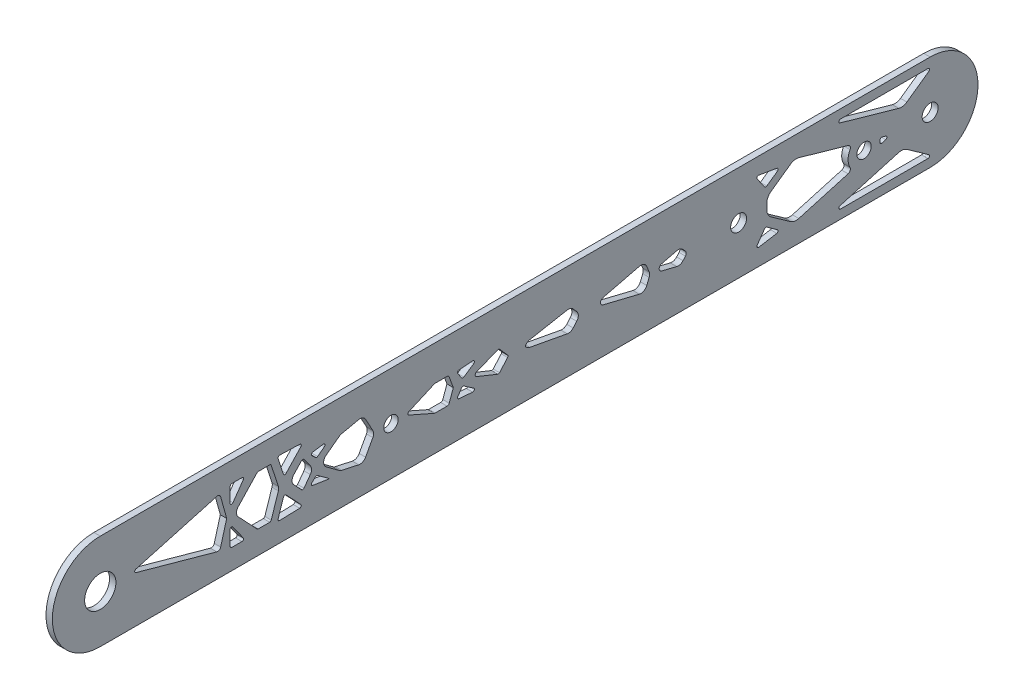
from build123d import *

# Parameters (mm, degrees)
SKETCH1_R           = 2.5
SKETCH1_R_2         = 4.9
BOSS_EXTRUDE1_DEPTH = 2
CUT_EXTRUDE1_DEPTH  = 216.531900191
SKETCH7_R           = 5
SKETCH7_R_2         = 2.25
BOSS_EXTRUDE2_DEPTH = 2
FILLET1_R           = 1
FILLET2_R           = 0.5
SKETCH8_R           = 2.25
CUT_EXTRUDE2_DEPTH  = 216.531900191


with BuildPart() as part:
    # Sketch1 → Boss-Extrude1 (new body)
    with BuildSketch(Plane(origin=(0, 0, 0), x_dir=(0, 0, -1), z_dir=(1, 0, 0))):
        with BuildLine():
            Line((-200, -15), (60, -15))
            ThreePointArc((60, -15), (75, 0), (60, 15))
            Line((60, 15), (-200, 15))
            ThreePointArc((-200, 15), (-215, 0), (-200, -15))
        make_face()
        Circle(SKETCH1_R, mode=Mode.SUBTRACT)
        with Locations((-200, 0)):
            Circle(SKETCH1_R_2, mode=Mode.SUBTRACT)
        with Locations((60, 0)):
            Circle(SKETCH1_R, mode=Mode.SUBTRACT)
    extrude(amount=BOSS_EXTRUDE1_DEPTH)

    # Sketch6 → Cut-Extrude1 (cut, through all)
    with BuildSketch(Plane(origin=(2, 0, 0), x_dir=(0, 0, -1), z_dir=(1, 0, 0))):
        with BuildLine():
            Line((-160.387518607, 0), (-189.218486106, 0))
            ThreePointArc((-189.218486106, 0), (-189.116527034, -0.302594481), (-188.852232426, -0.481779952))
            Line((-188.852232426, -0.481779952), (-163.511971077, -7.516457709))
            ThreePointArc((-163.511971077, -7.516457709), (-162.752284555, -7.423383407), (-162.280918534, -6.820390446))
            Line((-162.280918534, -6.820390446), (-160.387518607, 0))
        make_face()
        with BuildLine():
            Line((-163.511971077, 7.516457709), (-188.852232426, 0.481779952))
            ThreePointArc((-188.852232426, 0.481779952), (-189.116527034, 0.302594481), (-189.218486106, 0))
            Line((-189.218486106, 0), (-160.387518607, 0))
            Line((-160.387518607, 0), (-162.280918534, 6.820390446))
            ThreePointArc((-162.280918534, 6.820390446), (-162.752284555, 7.423383407), (-163.511971077, 7.516457709))
        make_face()
        with BuildLine():
            ThreePointArc((-158.441063495, 3.28827881), (-159.004316888, 3.101172405), (-159.349495678, 3.583992034))
            Line((-159.349495678, 3.583992034), (-159.281815463, 8.171745651))
            ThreePointArc((-159.281815463, 8.171745651), (-159.132805975, 8.520521707), (-158.781869862, 8.664370271))
            Line((-158.781869862, 8.664370271), (-155.611198944, 8.664370271))
            ThreePointArc((-155.611198944, 8.664370271), (-155.167256987, 8.394404049), (-155.202712362, 7.876032428))
            Line((-155.202712362, 7.876032428), (-158.441063495, 3.28827881))
        make_face()
        with BuildLine():
            Line((-155.202712362, -7.876032428), (-158.441063495, -3.28827881))
            ThreePointArc((-158.441063495, -3.28827881), (-159.004316888, -3.101172405), (-159.349495678, -3.583992034))
            Line((-159.349495678, -3.583992034), (-159.281815463, -8.171745651))
            ThreePointArc((-159.281815463, -8.171745651), (-159.132805975, -8.520521707), (-158.781869862, -8.664370271))
            Line((-158.781869862, -8.664370271), (-155.611198944, -8.664370271))
            ThreePointArc((-155.611198944, -8.664370271), (-155.167256987, -8.394404049), (-155.202712362, -7.876032428))
        make_face()
        with BuildLine():
            Line((-144.106911567, 0), (-157.316107182, 0))
            ThreePointArc((-157.316107182, 0), (-157.17487211, -0.738236375), (-156.771114237, -1.372207881))
            Line((-156.771114237, -1.372207881), (-150.872257463, -7.62700232))
            ThreePointArc((-150.872257463, -7.62700232), (-150.706589034, -7.743039657), (-150.508505699, -7.783950349))
            Line((-150.508505699, -7.783950349), (-146.910114815, -7.783950349))
            ThreePointArc((-146.910114815, -7.783950349), (-146.616589567, -7.688725508), (-146.4348679, -7.439322065))
            Line((-146.4348679, -7.439322065), (-144.205923908, -0.621486864))
            ThreePointArc((-144.205923908, -0.621486864), (-144.131819757, -0.314662266), (-144.106911567, 0))
        make_face()
        with BuildLine():
            Line((-150.872257463, 7.62700232), (-156.771114237, 1.372207881))
            ThreePointArc((-156.771114237, 1.372207881), (-157.17487211, 0.738236375), (-157.316107182, 0))
            Line((-157.316107182, 0), (-144.106911567, 0))
            ThreePointArc((-144.106911567, 0), (-144.131819757, 0.314662266), (-144.205923908, 0.621486864))
            Line((-144.205923908, 0.621486864), (-146.4348679, 7.439322065))
            ThreePointArc((-146.4348679, 7.439322065), (-146.616589567, 7.688725508), (-146.910114815, 7.783950349))
            Line((-146.910114815, 7.783950349), (-150.508505699, 7.783950349))
            ThreePointArc((-150.508505699, 7.783950349), (-150.706589034, 7.743039657), (-150.872257463, 7.62700232))
        make_face()
        with BuildLine():
            Line((-144.289070364, 8.21465924), (-142.621995221, 3.115453681))
            ThreePointArc((-142.621995221, 3.115453681), (-142.255898486, 2.782884583), (-141.782996543, 2.927773427))
            Line((-141.782996543, 2.927773427), (-137.160406237, 7.829291337))
            ThreePointArc((-137.160406237, 7.829291337), (-137.062013564, 8.363190155), (-137.508450482, 8.672096521))
            Line((-137.508450482, 8.672096521), (-143.798115931, 8.869784169))
            ThreePointArc((-143.798115931, 8.869784169), (-144.213937536, 8.66987878), (-144.289070364, 8.21465924))
        make_face()
        with BuildLine():
            Line((-136.941868438, 3.940489429), (-139.363998399, 1.372207881))
            ThreePointArc((-139.363998399, 1.372207881), (-139.767756271, 0.738236375), (-139.908991344, 0))
            Line((-139.908991344, 0), (-133.794664142, 0))
            ThreePointArc((-133.794664142, 0), (-133.894330967, 0.623485221), (-134.183397964, 1.184829651))
            Line((-134.183397964, 1.184829651), (-136.17530013, 3.893644871))
            ThreePointArc((-136.17530013, 3.893644871), (-136.547618848, 4.096506474), (-136.941868438, 3.940489429))
        make_face()
        with BuildLine():
            Line((-133.794664142, 0), (-139.908991344, 0))
            ThreePointArc((-139.908991344, 0), (-139.767756271, -0.738236375), (-139.363998399, -1.372207881))
            Line((-139.363998399, -1.372207881), (-136.941868438, -3.940489429))
            ThreePointArc((-136.941868438, -3.940489429), (-136.547618848, -4.096506474), (-136.17530013, -3.893644871))
            Line((-136.17530013, -3.893644871), (-134.183397964, -1.184829651))
            ThreePointArc((-134.183397964, -1.184829651), (-133.894330967, -0.623485221), (-133.794664142, 0))
        make_face()
        with BuildLine():
            Line((-141.782996543, -2.927773427), (-137.160406237, -7.829291337))
            ThreePointArc((-137.160406237, -7.829291337), (-137.062013564, -8.363190155), (-137.508450482, -8.672096521))
            Line((-137.508450482, -8.672096521), (-143.798115931, -8.869784169))
            ThreePointArc((-143.798115931, -8.869784169), (-144.213937536, -8.66987878), (-144.289070364, -8.21465924))
            Line((-144.289070364, -8.21465924), (-142.621995221, -3.115453681))
            ThreePointArc((-142.621995221, -3.115453681), (-142.255898486, -2.782884583), (-141.782996543, -2.927773427))
        make_face()
        with BuildLine():
            ThreePointArc((-133.687890504, 3.671215981), (-133.821985013, 4.184404142), (-133.419111422, 4.529420511))
            Line((-133.419111422, 4.529420511), (-130.170546878, 5.017394871))
            ThreePointArc((-130.170546878, 5.017394871), (-129.634119484, 4.713764568), (-129.800066577, 4.12012556))
            Line((-129.800066577, 4.12012556), (-131.916130789, 2.564097354))
            ThreePointArc((-131.916130789, 2.564097354), (-132.242836028, 2.467844883), (-132.555390172, 2.603162135))
            Line((-132.555390172, 2.603162135), (-133.687890504, 3.671215981))
        make_face()
        with BuildLine():
            Line((-114.350924762, 0), (-130.014294567, 0))
            ThreePointArc((-130.014294567, 0), (-129.800060714, -0.900577185), (-129.2032553, -1.60822025))
            Line((-129.2032553, -1.60822025), (-125.118424257, -4.628144737))
            ThreePointArc((-125.118424257, -4.628144737), (-124.754088837, -4.842009306), (-124.352958976, -4.974573202))
            Line((-124.352958976, -4.974573202), (-119.054817166, -6.122472025))
            ThreePointArc((-119.054817166, -6.122472025), (-117.800502555, -5.987092263), (-116.876777705, -5.127810456))
            Line((-116.876777705, -5.127810456), (-114.596380754, -0.959987147))
            ThreePointArc((-114.596380754, -0.959987147), (-114.413260186, -0.495435154), (-114.350924762, 0))
        make_face()
        with BuildLine():
            Line((-125.118424257, 4.628144737), (-129.2032553, 1.60822025))
            ThreePointArc((-129.2032553, 1.60822025), (-129.800060714, 0.900577185), (-130.014294567, 0))
            Line((-130.014294567, 0), (-114.350924762, 0))
            ThreePointArc((-114.350924762, 0), (-114.413260186, 0.495435154), (-114.596380754, 0.959987147))
            Line((-114.596380754, 0.959987147), (-116.876777705, 5.127810456))
            ThreePointArc((-116.876777705, 5.127810456), (-117.800502555, 5.987092263), (-119.054817166, 6.122472025))
            Line((-119.054817166, 6.122472025), (-124.352958976, 4.974573202))
            ThreePointArc((-124.352958976, 4.974573202), (-124.754088837, 4.842009306), (-125.118424257, 4.628144737))
        make_face()
        with BuildLine():
            ThreePointArc((-95.354516015, 3.948351078), (-95.216662794, 3.992625214), (-95.072650419, 4.007596694))
            Line((-95.072650419, 4.007596694), (-91.343671093, 4.007596694))
            ThreePointArc((-91.343671093, 4.007596694), (-90.942071896, 3.880962942), (-90.68575038, 3.546871184))
            Line((-90.68575038, 3.546871184), (-89.38602091, -0.025114208))
            Line((-89.38602091, -0.025114208), (-90.68575038, -3.597099601))
            ThreePointArc((-90.68575038, -3.597099601), (-90.942071896, -3.931191358), (-91.343671093, -4.057825111))
            Line((-91.343671093, -4.057825111), (-95.072650419, -4.057825111))
            ThreePointArc((-95.072650419, -4.057825111), (-95.216662794, -4.042853631), (-95.354516015, -3.998579495))
            Line((-95.354516015, -3.998579495), (-103.348312339, -0.482803255))
            ThreePointArc((-103.348312339, -0.482803255), (-103.647014707, -0.025114208), (-103.348312339, 0.432574838))
            Line((-103.348312339, 0.432574838), (-95.354516015, 3.948351078))
        make_face()
        with BuildLine():
            ThreePointArc((-87.983713596, 3.094465217), (-88.021814121, 3.59277978), (-87.60946188, 3.875153085))
            Line((-87.60946188, 3.875153085), (-83.32148229, 4.206458055))
            ThreePointArc((-83.32148229, 4.206458055), (-82.811317825, 3.87392183), (-83.000791622, 3.295175078))
            Line((-83.000791622, 3.295175078), (-86.077453443, 1.191932368))
            ThreePointArc((-86.077453443, 1.191932368), (-86.451971768, 1.113302642), (-86.772395827, 1.322527477))
            Line((-86.772395827, 1.322527477), (-87.983713596, 3.094465217))
        make_face()
        with BuildLine():
            Line((-86.077453443, -1.242160785), (-83.000791622, -3.345403494))
            ThreePointArc((-83.000791622, -3.345403494), (-82.811317825, -3.924150246), (-83.32148229, -4.256686472))
            Line((-83.32148229, -4.256686472), (-87.60946188, -3.925381502))
            ThreePointArc((-87.60946188, -3.925381502), (-88.021814121, -3.643008197), (-87.983713596, -3.144693634))
            Line((-87.983713596, -3.144693634), (-86.772395827, -1.372755894))
            ThreePointArc((-86.772395827, -1.372755894), (-86.451971768, -1.163531059), (-86.077453443, -1.242160785))
        make_face()
        with BuildLine():
            Line((-72.252247937, -0.025114208), (-82.523690918, -0.025114208))
            ThreePointArc((-82.523690918, -0.025114208), (-82.403757825, -0.41697072), (-82.085048403, -0.674574635))
            Line((-82.085048403, -0.674574635), (-75.45970241, -3.342002241))
            ThreePointArc((-75.45970241, -3.342002241), (-75.157901578, -3.364762963), (-74.898260488, -3.209237091))
            Line((-74.898260488, -3.209237091), (-72.377544301, -0.356168864))
            ThreePointArc((-72.377544301, -0.356168864), (-72.284619977, -0.202100341), (-72.252247937, -0.025114208))
        make_face()
        with BuildLine():
            Line((-75.45970241, 3.291773824), (-82.085048403, 0.624346218))
            ThreePointArc((-82.085048403, 0.624346218), (-82.403757825, 0.366742303), (-82.523690918, -0.025114208))
            Line((-82.523690918, -0.025114208), (-72.252247937, -0.025114208))
            ThreePointArc((-72.252247937, -0.025114208), (-72.284619977, 0.151871924), (-72.377544301, 0.305940448))
            Line((-72.377544301, 0.305940448), (-74.898260488, 3.159008674))
            ThreePointArc((-74.898260488, 3.159008674), (-75.157901578, 3.314534546), (-75.45970241, 3.291773824))
        make_face()
        with BuildLine():
            Line((-50.23072058, -0.025114208), (-66.770151274, -0.025114208))
            ThreePointArc((-66.770151274, -0.025114208), (-66.72596227, -0.230629016), (-66.60120593, -0.399817844))
            Line((-66.60120593, -0.399817844), (-66.381182593, -0.594210808))
            ThreePointArc((-66.381182593, -0.594210808), (-65.934324144, -0.892682865), (-65.424127299, -1.061405188))
            Line((-65.424127299, -1.061405188), (-53.709404819, -3.249196135))
            ThreePointArc((-53.709404819, -3.249196135), (-52.691755274, -3.174448084), (-51.843426944, -2.607405836))
            Line((-51.843426944, -2.607405836), (-50.731906037, -1.349332833))
            ThreePointArc((-50.731906037, -1.349332833), (-50.360208741, -0.733058738), (-50.23072058, -0.025114208))
        make_face()
        with BuildLine():
            Line((-66.381182593, 0.543982391), (-66.60120593, 0.349589427))
            ThreePointArc((-66.60120593, 0.349589427), (-66.72596227, 0.180400599), (-66.770151274, -0.025114208))
            Line((-66.770151274, -0.025114208), (-50.23072058, -0.025114208))
            ThreePointArc((-50.23072058, -0.025114208), (-50.360208741, 0.682830321), (-50.731906037, 1.299104416))
            Line((-50.731906037, 1.299104416), (-51.843426944, 2.557177419))
            ThreePointArc((-51.843426944, 2.557177419), (-52.691755274, 3.124219667), (-53.709404819, 3.198967719))
            Line((-53.709404819, 3.198967719), (-65.424127299, 1.011176771))
            ThreePointArc((-65.424127299, 1.011176771), (-65.934324144, 0.842454448), (-66.381182593, 0.543982391))
        make_face()
        with BuildLine():
            ThreePointArc((-28.033831677, -0.772067352), (-27.925624404, -0.405536047), (-27.889110901, -0.025114208))
            Line((-27.889110901, -0.025114208), (-28.101011597, -0.025114208))
            Line((-28.101011597, -0.025114208), (-43.300348158, -0.025114208))
            ThreePointArc((-43.300348158, -0.025114208), (-43.087233992, -0.642212809), (-42.538726791, -0.996286504))
            Line((-42.538726791, -0.996286504), (-31.104792979, -3.802797282))
            ThreePointArc((-31.104792979, -3.802797282), (-29.715719498, -3.640250187), (-28.772756488, -2.607405836))
            Line((-28.772756488, -2.607405836), (-28.033831677, -0.772067352))
        make_face()
        with BuildLine():
            Line((-28.101011597, -0.025114208), (-27.889110901, -0.025114208))
            ThreePointArc((-27.889110901, -0.025114208), (-27.925624404, 0.355307631), (-28.033831677, 0.721838936))
            Line((-28.033831677, 0.721838936), (-28.772756488, 2.557177419))
            ThreePointArc((-28.772756488, 2.557177419), (-29.715719498, 3.59002177), (-31.104792979, 3.752568865))
            Line((-31.104792979, 3.752568865), (-42.538726791, 0.946058087))
            ThreePointArc((-42.538726791, 0.946058087), (-43.087233992, 0.591984393), (-43.300348158, -0.025114208))
            Line((-43.300348158, -0.025114208), (-28.101011597, -0.025114208))
        make_face()
        with BuildLine():
            ThreePointArc((46.101289656, -0.480865561), (46.363352779, -0.301248449), (46.464292167, 0))
            Line((46.464292167, 0), (8.862269699, 0))
            Line((8.862269699, 0), (8.862269699, -1.003061708))
            ThreePointArc((8.862269699, -1.003061708), (9.198483846, -2.383005523), (10.13176632, -3.453644915))
            Line((10.13176632, -3.453644915), (16.299972112, -7.809383965))
            ThreePointArc((16.299972112, -7.809383965), (17.526915227, -8.316236651), (18.852460424, -8.243994126))
            Line((18.852460424, -8.243994126), (46.101289656, -0.480865561))
        make_face()
        with BuildLine():
            Line((46.101289656, 0.480865561), (18.852460424, 8.243994126))
            ThreePointArc((18.852460424, 8.243994126), (17.526915227, 8.316236651), (16.299972112, 7.809383965))
            Line((16.299972112, 7.809383965), (10.13176632, 3.453644915))
            ThreePointArc((10.13176632, 3.453644915), (9.198483846, 2.383005523), (8.862269699, 1.003061708))
            Line((8.862269699, 1.003061708), (8.862269699, 0))
            Line((8.862269699, 0), (46.464292167, 0))
            ThreePointArc((46.464292167, 0), (46.363352779, 0.301248449), (46.101289656, 0.480865561))
        make_face()
        with BuildLine():
            ThreePointArc((5.799581308, 8.997150503), (5.784443147, 9.551254693), (6.2898889, 9.778818326))
            Line((6.2898889, 9.778818326), (11.966182051, 8.836582892))
            ThreePointArc((11.966182051, 8.836582892), (12.37168234, 8.454971545), (12.172722222, 7.934901765))
            Line((12.172722222, 7.934901765), (8.829122787, 5.573786212))
            ThreePointArc((8.829122787, 5.573786212), (8.455843335, 5.489470967), (8.132275022, 5.693799517))
            Line((8.132275022, 5.693799517), (5.799581308, 8.997150503))
        make_face()
        with BuildLine():
            ThreePointArc((8.132275022, -5.693799517), (8.455843335, -5.489470967), (8.829122787, -5.573786212))
            Line((8.829122787, -5.573786212), (12.172722222, -7.934901765))
            ThreePointArc((12.172722222, -7.934901765), (12.37168234, -8.454971545), (11.966182051, -8.836582892))
            Line((11.966182051, -8.836582892), (6.2898889, -9.778818326))
            ThreePointArc((6.2898889, -9.778818326), (5.784443147, -9.551254693), (5.799581308, -8.997150503))
            Line((5.799581308, -8.997150503), (8.132275022, -5.693799517))
        make_face()
        with BuildLine():
            Line((52.708309357, -6.425018306), (59.613698891, -11.301326889))
            ThreePointArc((59.613698891, -11.301326889), (59.801839773, -11.861059659), (59.325281662, -12.209757423))
            Line((59.325281662, -12.209757423), (31.905573358, -12.209757423))
            ThreePointArc((31.905573358, -12.209757423), (31.410380072, -11.778921067), (31.768575869, -11.228891862))
            Line((31.768575869, -11.228891862), (50.155821045, -5.990408145))
            ThreePointArc((50.155821045, -5.990408145), (51.481366242, -5.91816562), (52.708309357, -6.425018306))
        make_face()
        with BuildLine():
            Line((31.768575869, 11.228891862), (50.155821045, 5.990408145))
            ThreePointArc((50.155821045, 5.990408145), (51.481366242, 5.91816562), (52.708309357, 6.425018306))
            Line((52.708309357, 6.425018306), (59.613698891, 11.301326889))
            ThreePointArc((59.613698891, 11.301326889), (59.801839773, 11.861059659), (59.325281662, 12.209757423))
            Line((59.325281662, 12.209757423), (31.905573358, 12.209757423))
            ThreePointArc((31.905573358, 12.209757423), (31.410380072, 11.778921067), (31.768575869, 11.228891862))
        make_face()
        with BuildLine():
            Line((-128.171501014, -5.317676153), (-133.419111422, -4.529420511))
            ThreePointArc((-133.419111422, -4.529420511), (-133.821985013, -4.184404142), (-133.687890504, -3.671215981))
            Line((-133.687890504, -3.671215981), (-132.555390172, -2.603162135))
            ThreePointArc((-132.555390172, -2.603162135), (-132.242836028, -2.467844883), (-131.916130789, -2.564097354))
            Line((-131.916130789, -2.564097354), (-128.171501014, -5.317676153))
        make_face()
        with BuildLine():
            Line((-19.393939485, -2.160034482), (-24.139937522, -0.996345093))
            ThreePointArc((-24.139937522, -0.996345093), (-24.901797712, -0.025114208), (-24.139937522, 0.946116676))
            Line((-24.139937522, 0.946116676), (-19.393939485, 2.109806065))
            ThreePointArc((-19.393939485, 2.109806065), (-18.320206465, 2.076021702), (-17.41884532, 1.491562921))
            Line((-17.41884532, 1.491562921), (-16.663825545, 0.636995104))
            ThreePointArc((-16.663825545, 0.636995104), (-16.413232817, -0.025114208), (-16.663825545, -0.68722352))
            Line((-16.663825545, -0.68722352), (-17.41884532, -1.541791338))
            ThreePointArc((-17.41884532, -1.541791338), (-18.320206465, -2.126250119), (-19.393939485, -2.160034482))
        make_face()
    extrude(amount=-CUT_EXTRUDE1_DEPTH, mode=Mode.SUBTRACT)

    # Sketch7 → Boss-Extrude2 (add)
    with BuildSketch(Plane(origin=(2, 0, 0), x_dir=(0, 0, -1), z_dir=(1, 0, 0))):
        with Locations((39.292486377, 0)):
            Circle(SKETCH7_R)
        with Locations((39.292486377, 0)):
            Circle(SKETCH7_R_2, mode=Mode.SUBTRACT)
    extrude(amount=-BOSS_EXTRUDE2_DEPTH)

    # Fillet1
    fillet1_edges = [part.edges().sort_by_distance(p)[0] for p in [
        (1, -3.451365105, -35.674741373),
        (1, 3.451365105, -35.674741373),
    ]]
    fillet(fillet1_edges, radius=FILLET1_R)

    # Fillet2
    fillet2_edges = [part.edges().sort_by_distance(p)[0] for p in [
        (1, -1.026534397, -44.185974614),
        (1, 1.026534397, -44.185974614),
    ]]
    fillet(fillet2_edges, radius=FILLET2_R)

    # Sketch8 → Cut-Extrude2 (cut, through all)
    with BuildSketch(Plane(origin=(2, 0, 0), x_dir=(0, 0, -1), z_dir=(1, 0, 0))):
        with Locations((-108.925325125, 0)):
            Circle(SKETCH8_R)
    extrude(amount=-CUT_EXTRUDE2_DEPTH, mode=Mode.SUBTRACT)


solid = part.part
